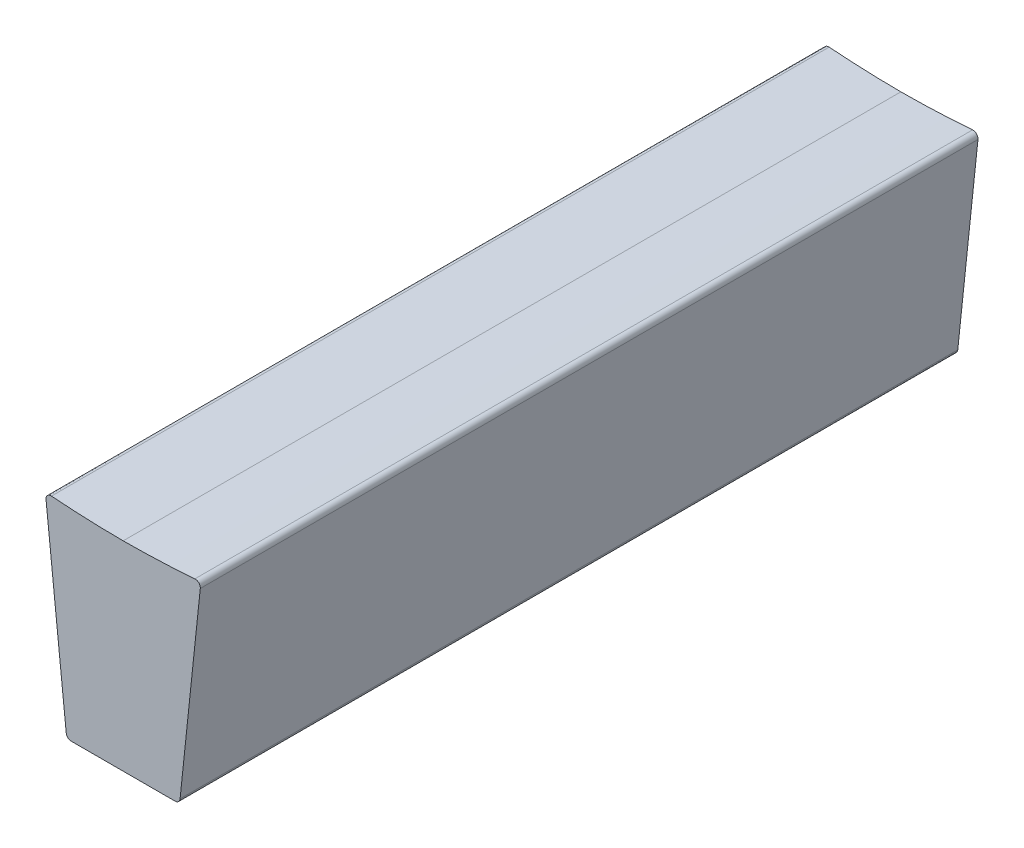
from build123d import *

# Parameters (mm, degrees)
BOSS_EXTRUDE1_DEPTH = 115
FILLET1_R           = 0.75


with BuildPart() as part:
    # Sketch1 → Boss-Extrude1 (new body)
    with BuildSketch(Plane.XY):
        with BuildLine():
            Line((8.346872942, 0), (-8.346872942, 0))
            Line((-8.346872942, 0), (-11.5, 30))
            ThreePointArc((-11.5, 30), (-5.75495213, 29.636101007), (0, 29.5))
            ThreePointArc((0, 29.5), (5.75495213, 29.636101007), (11.5, 30))
            Line((11.5, 30), (8.346872942, 0))
        make_face()
    extrude(amount=-BOSS_EXTRUDE1_DEPTH)

    # Fillet1
    fillet1_edges = [part.edges().sort_by_distance(p)[0] for p in [
        (-11.5, 30, -57.5),
        (11.5, 30, -57.5),
        (8.346872942, 0, -57.5),
        (-8.346872942, 0, -57.5),
    ]]
    fillet(fillet1_edges, radius=FILLET1_R)


solid = part.part
